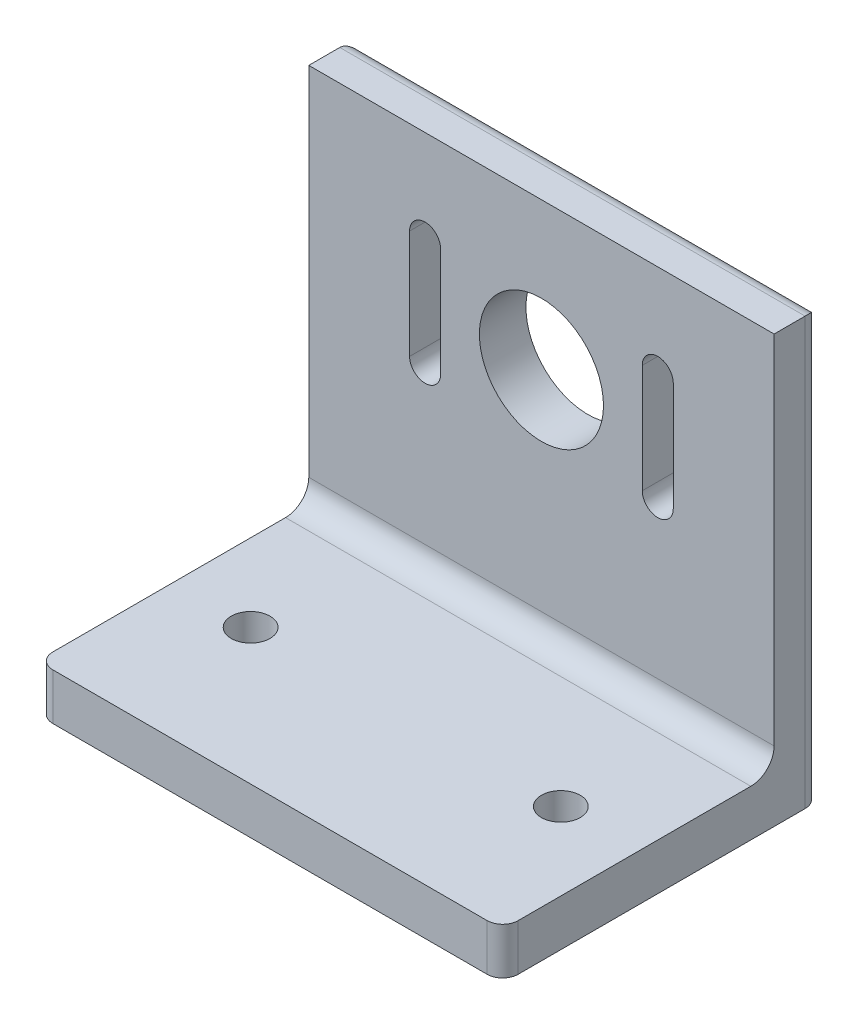
from build123d import *

# Parameters (mm, degrees)
SKETCH2_W           = 60
SKETCH2_H           = 35
BOSS_EXTRUDE1_DEPTH = 6
SKETCH3_W           = 60
SKETCH3_H           = 55
BOSS_EXTRUDE2_DEPTH = 6
SKETCH4_R           = 8
CUT_EXTRUDE1_DEPTH  = 72.763500472
CUT_EXTRUDE2_DEPTH  = 72.763500472
SKETCH6_R           = 2.5
CUT_EXTRUDE3_DEPTH  = 6
FILLET1_R           = 2
FILLET2_R           = 3


with BuildPart() as part:
    # Sketch2 → Boss-Extrude1 (new body)
    with BuildSketch(Plane(origin=(0, 0, 0), x_dir=(1, 0, 0), z_dir=(0, 1, 0))):
        Rectangle(SKETCH2_W, SKETCH2_H)
    extrude(amount=BOSS_EXTRUDE1_DEPTH)

    # Sketch3 → Boss-Extrude2 (add)
    with BuildSketch(Plane(origin=(0, 0, -17.5), x_dir=(-1, 0, 0), z_dir=(0, 0, -1))):
        with Locations((0, 27.5)):
            Rectangle(SKETCH3_W, SKETCH3_H)
    extrude(amount=BOSS_EXTRUDE2_DEPTH)

    # Sketch4 → Cut-Extrude1 (cut, through all)
    with BuildSketch(Plane.XY.offset(-17.5)):
        with Locations((0, 36)):
            Circle(SKETCH4_R)
    extrude(amount=-CUT_EXTRUDE1_DEPTH, mode=Mode.SUBTRACT)

    # Sketch5 → Cut-Extrude2 (cut, through all)
    with BuildSketch(Plane.XY.offset(-17.5)):
        with BuildLine():
            Line((-13, 43), (-13, 29))
            ThreePointArc((-13, 29), (-15, 27), (-17, 29))
            Line((-17, 29), (-17, 43))
            ThreePointArc((-17, 43), (-15, 45), (-13, 43))
        make_face()
        with BuildLine():
            Line((17, 43), (17, 29))
            ThreePointArc((17, 29), (15, 27), (13, 29))
            Line((13, 29), (13, 43))
            ThreePointArc((13, 43), (15, 45), (17, 43))
        make_face()
    extrude(amount=-CUT_EXTRUDE2_DEPTH, mode=Mode.SUBTRACT)

    # Sketch6 → Cut-Extrude3 (cut)
    with BuildSketch(Plane(origin=(0, 6, 0), x_dir=(1, 0, 0), z_dir=(0, 1, 0))):
        with Locations(Location((-20, 0, 0), (0, 0, 270))):
            Circle(SKETCH6_R)
        with Locations(Location((20, 0, 0), (0, 0, 270))):
            Circle(SKETCH6_R)
    extrude(amount=-CUT_EXTRUDE3_DEPTH, mode=Mode.SUBTRACT)

    # Fillet1
    fillet1_edges = [part.edges().sort_by_distance(p)[0] for p in [
        (30, 27.5, -23.5),
        (-30, 27.5, -23.5),
        (0, 55, -23.5),
        (30, 3, 17.5),
        (-30, 3, 17.5),
    ]]
    fillet(fillet1_edges, radius=FILLET1_R)

    # Fillet2
    fillet2_edges = [part.edges().sort_by_distance(p)[0] for p in [
        (0, 6, -17.5),
    ]]
    fillet(fillet2_edges, radius=FILLET2_R)


solid = part.part
